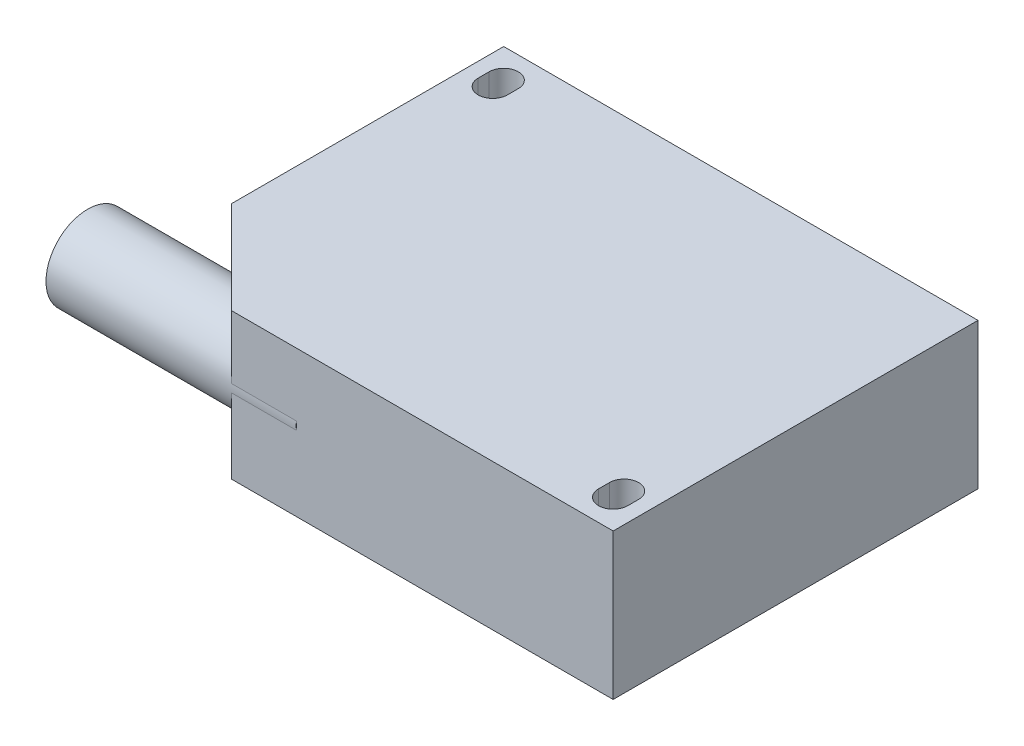
from build123d import *

# Parameters (mm, degrees)
BOSS_EXTRUDE1_DEPTH      = 20
BOSS_EXTRUDE2_DEPTH      = 12.7
BOSS_EXTRUDE2_DEPTH_BACK = 21.59
SKETCH2_R                = 5.710413334
CUT_EXTRUDE1_DEPTH       = 56.401981837


with BuildPart() as part:
    # Sketch1 → Boss-Extrude1 (new body)
    with BuildSketch(Plane(origin=(0, 0, 0), x_dir=(1, 0, 0), z_dir=(0, 1, 0))):
        Polygon((-32.500000024, -12.3), (-19.800000024, -25), (32.500000024, -25), (32.500000024, 25), (-32.500000024, 25), align=None)
    extrude(amount=BOSS_EXTRUDE1_DEPTH)

    # Sketch2 → Boss-Extrude2 (add, two sides: drawn at the far end of the back side and taken through both)
    with BuildSketch(Plane.ZY.offset(32.500000024).offset(-BOSS_EXTRUDE2_DEPTH_BACK)):
        with Locations((19.316364111, 10.795)):
            Circle(SKETCH2_R)
    extrude(amount=BOSS_EXTRUDE2_DEPTH + BOSS_EXTRUDE2_DEPTH_BACK)

    # Sketch3 → Cut-Extrude1 (cut, through all)
    with BuildSketch(Plane(origin=(0, 20, 0), x_dir=(1, 0, 0), z_dir=(0, 1, 0))):
        with BuildLine():
            Line((30.500000024, -19.5), (30.500000024, -21))
            ThreePointArc((30.500000024, -21), (28.500000024, -23), (26.500000024, -21))
            Line((26.500000024, -21), (26.500000024, -19.5))
            ThreePointArc((26.500000024, -19.5), (28.500000024, -17.5), (30.500000024, -19.5))
        make_face()
        with BuildLine():
            Line((-26.500000024, 21), (-26.500000024, 19.5))
            ThreePointArc((-26.500000024, 19.5), (-28.500000024, 17.5), (-30.500000024, 19.5))
            Line((-30.500000024, 19.5), (-30.500000024, 21))
            ThreePointArc((-30.500000024, 21), (-28.500000024, 23), (-26.500000024, 21))
        make_face()
    extrude(amount=-CUT_EXTRUDE1_DEPTH, mode=Mode.SUBTRACT)


solid = part.part
